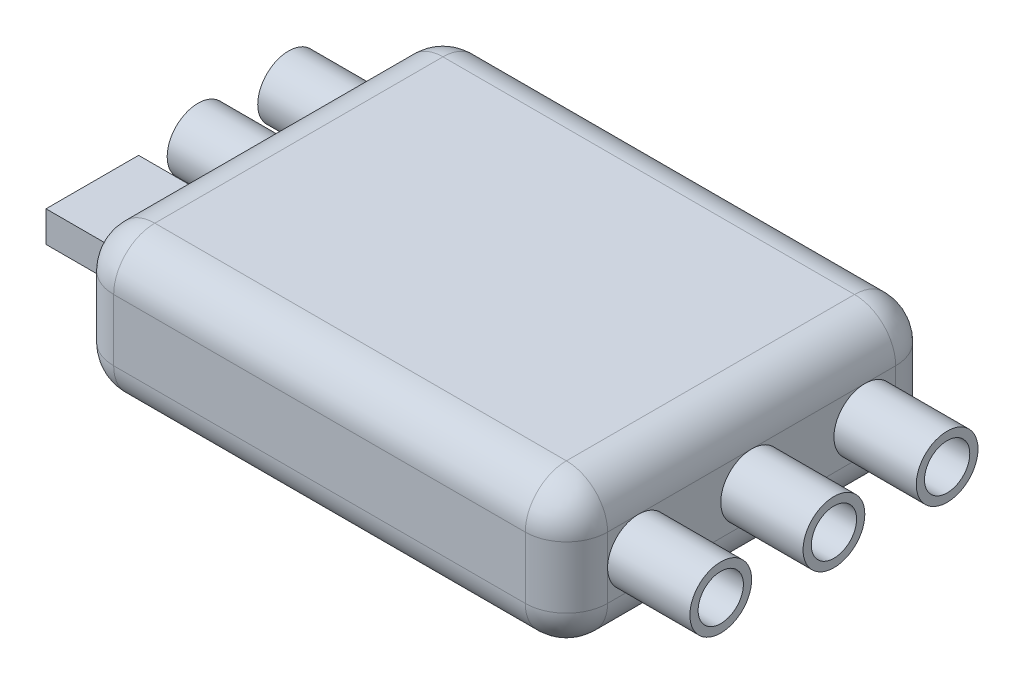
from build123d import *

# Parameters (mm, degrees)
BOSS_EXTRUDE1_DEPTH = 7
FILLET1_R           = 2
SKETCH2_R           = 1.5
SKETCH2_R_2         = 1.1
BOSS_EXTRUDE2_DEPTH = 4
BOSS_EXTRUDE3_START = 4
SKETCH3_R           = 1.5
SKETCH3_R_2         = 1.1
SKETCH3_W           = 4.5
SKETCH3_H           = 1.5
BOSS_EXTRUDE3_DEPTH = 4


with BuildPart() as part:
    # Sketch1 → Boss-Extrude1 (new body)
    with BuildSketch(Plane(origin=(0, 0, 0), x_dir=(1, 0, 0), z_dir=(0, 1, 0))):
        with BuildLine():
            Line((10, 9), (-10, 9))
            ThreePointArc((-10, 9), (-11.414213562, 8.414213562), (-12, 7))
            Line((-12, 7), (-12, -7))
            ThreePointArc((-12, -7), (-11.414213562, -8.414213562), (-10, -9))
            Line((-10, -9), (10, -9))
            ThreePointArc((10, -9), (11.414213562, -8.414213562), (12, -7))
            Line((12, -7), (12, 7))
            ThreePointArc((12, 7), (11.414213562, 8.414213562), (10, 9))
        make_face()
    extrude(amount=BOSS_EXTRUDE1_DEPTH)

    # Fillet1
    fillet1_edges = [part.edges().sort_by_distance(p)[0] for p in [
        (0, 0, 9),
        (-11.414213562, 0, 8.414213562),
        (-12, 0, 0),
        (-11.414213562, 0, -8.414213562),
        (-11.414213562, 7, 8.414213562),
        (0, 7, 9),
        (11.414213562, 7, 8.414213562),
        (12, 7, 0),
        (11.414213562, 7, -8.414213562),
        (0, 7, -9),
        (-11.414213562, 7, -8.414213562),
        (0, 0, -9),
        (-12, 7, 0),
        (11.414213562, 0, -8.414213562),
        (12, 0, 0),
        (11.414213562, 0, 8.414213562),
    ]]
    fillet(fillet1_edges, radius=FILLET1_R)

    # Sketch2 → Boss-Extrude2 (add)
    # profile 1 of 3: a face of its own
    with BuildSketch(Plane(origin=(12, 0, 0), x_dir=(0, 0, -1), z_dir=(1, 0, 0))):
        with Locations(Location((0, 3.5, 0), (0, 0, 270))):
            Circle(SKETCH2_R)
        with Locations((0, 3.5)):
            Circle(SKETCH2_R_2, mode=Mode.SUBTRACT)
    # profile 2 of 3: a face of its own
    with BuildSketch(Plane(origin=(12, 0, 0), x_dir=(0, 0, -1), z_dir=(1, 0, 0))):
        with Locations(Location((-5.5, 3.5, 0), (0, 0, 180))):
            Circle(SKETCH2_R)
        with Locations((-5.5, 3.5)):
            Circle(SKETCH2_R_2, mode=Mode.SUBTRACT)
    # profile 3 of 3: a face of its own
    with BuildSketch(Plane(origin=(12, 0, 0), x_dir=(0, 0, -1), z_dir=(1, 0, 0))):
        with Locations((5.5, 3.5)):
            Circle(SKETCH2_R)
        with Locations((5.5, 3.5)):
            Circle(SKETCH2_R_2, mode=Mode.SUBTRACT)
    extrude(amount=BOSS_EXTRUDE2_DEPTH)

    # Sketch3 → Boss-Extrude3 (add)
    # profile 1 of 3: a face of its own
    with BuildSketch(Plane.ZY.offset(12).offset(BOSS_EXTRUDE3_START)):
        with Locations(Location((-5.5, 3.5, 0), (0, 0, 180))):
            Circle(SKETCH3_R)
        with Locations(Location((-5.5, 3.5, 0), (0, 0, 180))):
            Circle(SKETCH3_R_2, mode=Mode.SUBTRACT)
    # profile 2 of 3: a face of its own
    with BuildSketch(Plane.ZY.offset(12).offset(BOSS_EXTRUDE3_START)):
        with Locations(Location((-1.1, 3.5, 0), (0, 0, 270))):
            Circle(SKETCH3_R)
        with Locations((-1.1, 3.5)):
            Circle(SKETCH3_R_2, mode=Mode.SUBTRACT)
    # profile 3 of 3: a face of its own
    with BuildSketch(Plane.ZY.offset(12).offset(BOSS_EXTRUDE3_START)):
        with Locations((4.038111206, 3.5)):
            Rectangle(SKETCH3_W, SKETCH3_H)
    extrude(amount=-BOSS_EXTRUDE3_DEPTH)


solid = part.part
